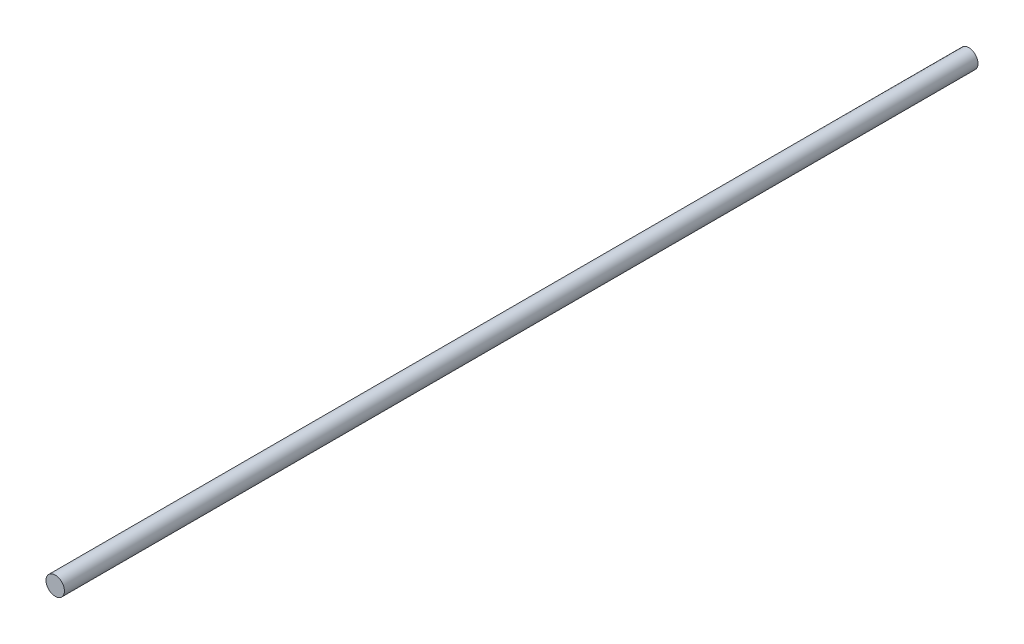
from build123d import *

# Parameters (mm, degrees)
SKETCH1_R           = 4
BOSS_EXTRUDE1_DEPTH = 198


with BuildPart() as part:
    # Sketch1 → Boss-Extrude1 (new, symmetric)
    with BuildSketch(Plane.XY):
        Circle(SKETCH1_R)
    extrude(amount=BOSS_EXTRUDE1_DEPTH, both=True)


solid = part.part
